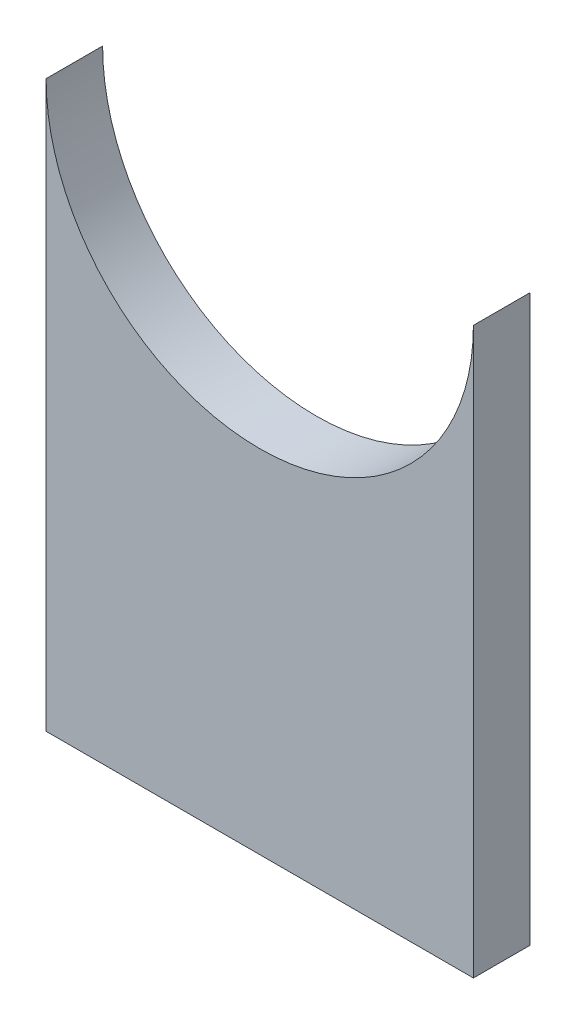
from build123d import *

# Parameters (mm, degrees)
BOSS_EXTRUDE1_DEPTH = 6.35


with BuildPart() as part:
    # Sketch1 → Boss-Extrude1 (new body)
    with BuildSketch(Plane.XY):
        with BuildLine():
            Line((-24.003, -63.5), (24.003, -63.5))
            Line((24.003, -63.5), (24.003, 0))
            ThreePointArc((24.003, 0), (0, -24.003), (-24.003, 0))
            Line((-24.003, 0), (-24.003, -63.5))
        make_face()
    extrude(amount=BOSS_EXTRUDE1_DEPTH)


solid = part.part
